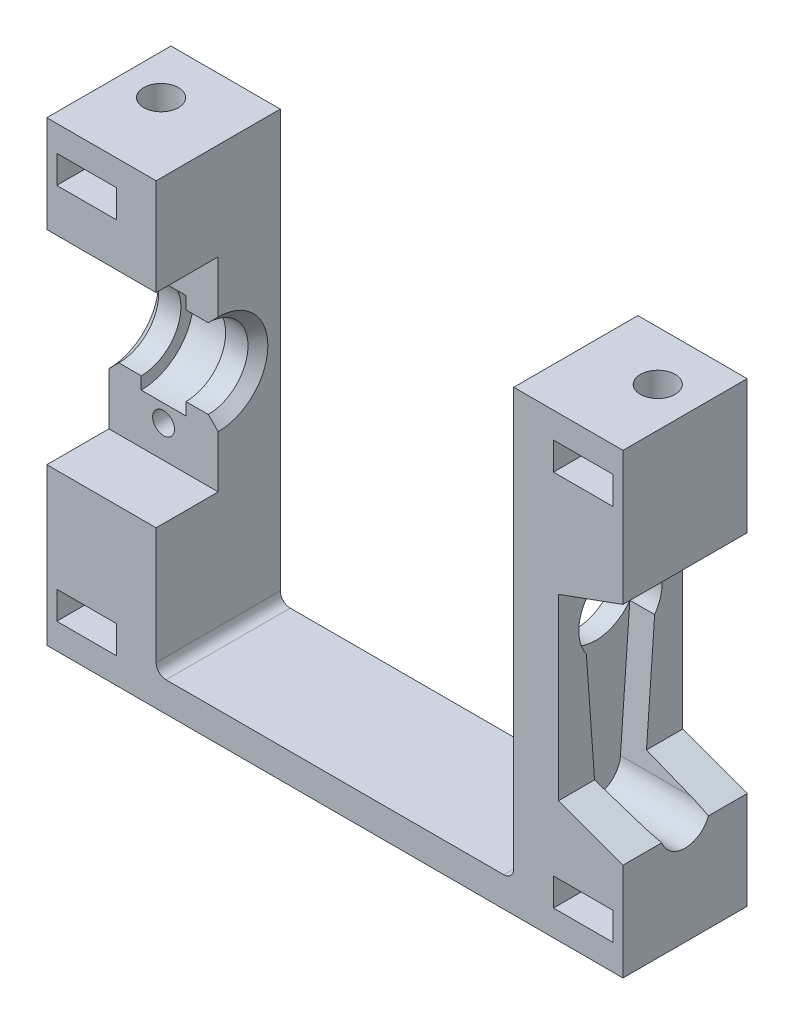
from build123d import *

# Parameters (mm, degrees)
SKETCH_1_W               = 58
SKETCH_1_H               = 46
EXTRUDE_509_DEPTH        = 12.5
SKETCH_3_W               = 36
SKETCH_3_H               = 46
CUT_EXTRUDE_752_DEPTH    = 40.067249711
SKETCH_11_R              = 1.75
CUT_EXTRUDE_1006_DEPTH   = 8
CUT_EXTRUDE_1504_DEPTH   = 9
CUT_EXTRUDE_1848_REACH   = 65.634
SKETCH_4_R               = 4.2
SKETCH_6_R               = 4
CUT_EXTRUDE_1985_DEPTH   = 11
SKETCH_7_W               = 6.25
SKETCH_7_H               = 20.5
CUT_EXTRUDE_2184_DEPTH   = 11
SKETCH_8_R               = 5.25
CUT_EXTRUDE_2361_DEPTH   = 2.25
SKETCH_9_R               = 1.1
CUT_EXTRUDE_2719_DEPTH   = 5.25
CUT_EXTRUDE_3116_DEPTH   = 40.067249711
CHAMFER_1_SIZE           = 1
FILLET_1_R               = 1
CUT_EXTRUDE_START        = -4
CUT_EXTRUDE_6414_DEPTH   = 1.4
CUT_EXTRUDE_6952_REACH   = 65.634
SKETCH_18_W              = 6
SKETCH_18_H              = 2.8
MIRROR_START             = -4
MIRROR_2_COPY_1_DEPTH    = 1.4
MIRROR_2_COPY_2_REACH    = 65.634
MIRROR_2_COPY_2_SKETCH_W = 6
MIRROR_2_COPY_2_SKETCH_H = 2.8


with BuildPart() as part:
    # Эскиз1 → Extrude 509 (new body)
    with BuildSketch(Plane.XY):
        Rectangle(SKETCH_1_W, SKETCH_1_H)
    extrude(amount=EXTRUDE_509_DEPTH)

    # Эскиз3 → Cut-Extrude 752 (cut, through all)
    with BuildSketch(Plane.XY.offset(12.5)):
        with Locations((0, 3)):
            Rectangle(SKETCH_3_W, SKETCH_3_H)
    extrude(amount=-CUT_EXTRUDE_752_DEPTH, mode=Mode.SUBTRACT)

    # Эскиз11 → Cut-Extrude 1006 (cut)
    with BuildSketch(Plane.XZ.offset(23)):
        with Locations(Location((-25, 5, 0), (0, 0, 270))):
            Circle(SKETCH_11_R)
        with Locations(Location((25, 5, 0), (0, 0, 270))):
            Circle(SKETCH_11_R)
    cut_extrude_1006 = extrude(amount=-CUT_EXTRUDE_1006_DEPTH, mode=Mode.SUBTRACT)

    # Mirror 1050: Cut-Extrude 1006 across plane
    add(cut_extrude_1006.mirror(Plane.ZX), mode=Mode.SUBTRACT)

    # Эскиз5 → Cut-Extrude 1504 (cut)
    with BuildSketch(Plane(origin=(29, 0, 0), x_dir=(0, 0, -1), z_dir=(1, 0, 0))):
        with BuildLine():
            Line((-9.688386067, 0.588050321), (-8.743490646, -12.48028976))
            ThreePointArc((-8.743490646, -12.48028976), (-6.25, -14.8), (-3.756509354, -12.48028976))
            Line((-3.756509354, -12.48028976), (-2.811613933, 0.588050321))
            ThreePointArc((-2.811613933, 0.588050321), (-6.25, 7.2), (-9.688386067, 0.588050321))
        make_face()
    extrude(amount=-CUT_EXTRUDE_1504_DEPTH, mode=Mode.SUBTRACT)

    # Эскиз4 → Cut-Extrude 1848 (cut, up to next)
    with BuildSketch(Plane(origin=(29, 0, 0), x_dir=(0, 0, -1), z_dir=(1, 0, 0)), mode=Mode.PRIVATE) as cut_extrude_1848_sk1:
        with Locations((-6.25, 3)):
            Circle(SKETCH_4_R)
    cut_extrude_1848_tool1 = extrude(cut_extrude_1848_sk1.sketch, amount=-CUT_EXTRUDE_1848_REACH, mode=Mode.PRIVATE) & part.part
    add(cut_extrude_1848_tool1.solids().sort_by_distance((29, 3, 6.25))[0], mode=Mode.SUBTRACT)

    # Эскиз6 → Cut-Extrude 1985 (cut)
    with BuildSketch(Plane.ZY.offset(29)):
        with Locations((6.25, 3)):
            Circle(SKETCH_6_R)
    extrude(amount=-CUT_EXTRUDE_1985_DEPTH, mode=Mode.SUBTRACT)

    # Эскиз7 → Cut-Extrude 2184 (cut)
    with BuildSketch(Plane.ZY.offset(29)):
        with Locations((9.375, 3)):
            Rectangle(SKETCH_7_W, SKETCH_7_H)
    extrude(amount=-CUT_EXTRUDE_2184_DEPTH, mode=Mode.SUBTRACT)

    # Эскиз8 → Cut-Extrude 2361 (cut, symmetric)
    with BuildSketch(Plane.ZY.offset(23.5)):
        with Locations((6.25, 3)):
            Circle(SKETCH_8_R)
    extrude(amount=CUT_EXTRUDE_2361_DEPTH, both=True, mode=Mode.SUBTRACT)

    # Эскиз9 → Cut-Extrude 2719 (cut)
    with BuildSketch(Plane.XY.offset(6.25)):
        with Locations((-23.5, 10)):
            Circle(SKETCH_9_R)
        with Locations((-23.5, -4)):
            Circle(SKETCH_9_R)
    extrude(amount=-CUT_EXTRUDE_2719_DEPTH, mode=Mode.SUBTRACT)

    # Эскиз10 → Cut-Extrude 3116 (cut, through all)
    with BuildSketch(Plane.XY.offset(12.5)):
        Polygon((29, -13.165806523), (29, 9.565806523), (22.5, 7.2), (22.5, -10.8), align=None)
    extrude(amount=-CUT_EXTRUDE_3116_DEPTH, mode=Mode.SUBTRACT)

    # Фаска1
    chamfer_1_edges = [part.edges().sort_by_distance(p)[0] for p in [
        (-29, 3, 2.25),
        (-18, 3, 2.25),
    ]]
    chamfer(chamfer_1_edges, length=CHAMFER_1_SIZE)

    # Скругление1
    fillet_1_edges = [part.edges().sort_by_distance(p)[0] for p in [
        (-18, -20, 6.25),
        (18, -20, 6.25),
    ]]
    fillet(fillet_1_edges, radius=FILLET_1_R)

    # Эскиз17 → Cut-Extrude 6414 (cut, symmetric)
    with BuildSketch(Plane(origin=(0, 23, 0), x_dir=(1, 0, 0), z_dir=(0, 1, 0)).offset(CUT_EXTRUDE_START)):
        Polygon((22, -3.267949192), (22, -6.732050808), (25, -8.464101615), (28, -6.732050808), (28, -3.267949192), (25, -1.535898385), align=None)
    cut_extrude_6414 = extrude(amount=CUT_EXTRUDE_6414_DEPTH, both=True, mode=Mode.SUBTRACT)

    # Эскиз18 → Cut-Extrude 6952 (cut, up to next)
    with BuildSketch(Plane(origin=(29, 0, 12.5), x_dir=(1, 0, 0), z_dir=(0, 0, 1)), mode=Mode.PRIVATE) as cut_extrude_6952_sk1:
        with Locations((-4, 19)):
            Rectangle(SKETCH_18_W, SKETCH_18_H)
    cut_extrude_6952_tool1 = extrude(cut_extrude_6952_sk1.sketch, amount=-CUT_EXTRUDE_6952_REACH, mode=Mode.PRIVATE) & part.part
    cut_extrude_6952 = cut_extrude_6952_tool1.solids().sort_by_distance((25, 19, 12.5))[0]
    add(cut_extrude_6952, mode=Mode.SUBTRACT)

    # Зеркальное отражение1: Cut-Extrude 6414, Cut-Extrude 6952 across plane
    add(cut_extrude_6414.mirror(Plane(origin=(0, 0, 0), x_dir=(0, 0, 1), z_dir=(1, 0, 0))), mode=Mode.SUBTRACT)
    add(cut_extrude_6952.mirror(Plane(origin=(0, 0, 0), x_dir=(0, 0, 1), z_dir=(1, 0, 0))), mode=Mode.SUBTRACT)

    # Зеркальное отражение2: Cut-Extrude 6414, Cut-Extrude 6952 across plane
    add(cut_extrude_6414.mirror(Plane.ZX), mode=Mode.SUBTRACT)
    add(cut_extrude_6952.mirror(Plane.ZX), mode=Mode.SUBTRACT)

    # Зеркальное отражение2 copy 1 sketch → Зеркальное отражение2 copy 1 (cut, symmetric)
    with BuildSketch(Plane(origin=(0, -23, 0), x_dir=(-1, 0, 0), z_dir=(0, -1, 0)).offset(MIRROR_START)):
        Polygon((22, -3.267949192), (22, -6.732050808), (25, -8.464101615), (28, -6.732050808), (28, -3.267949192), (25, -1.535898385), align=None)
    extrude(amount=MIRROR_2_COPY_1_DEPTH, both=True, mode=Mode.SUBTRACT)

    # Зеркальное отражение2 copy 2 sketch → Зеркальное отражение2 copy 2 (cut, up to next)
    with BuildSketch(Plane(origin=(-29, 0, 12.5), x_dir=(-1, 0, 0), z_dir=(0, 0, 1)), mode=Mode.PRIVATE) as mirror_2_copy_2_sk1:
        with Locations((-4, 19)):
            Rectangle(MIRROR_2_COPY_2_SKETCH_W, MIRROR_2_COPY_2_SKETCH_H)
    mirror_2_copy_2_tool1 = extrude(mirror_2_copy_2_sk1.sketch, amount=-MIRROR_2_COPY_2_REACH, mode=Mode.PRIVATE) & part.part
    add(mirror_2_copy_2_tool1.solids().sort_by_distance((-25, -19, 12.5))[0], mode=Mode.SUBTRACT)


solid = part.part
